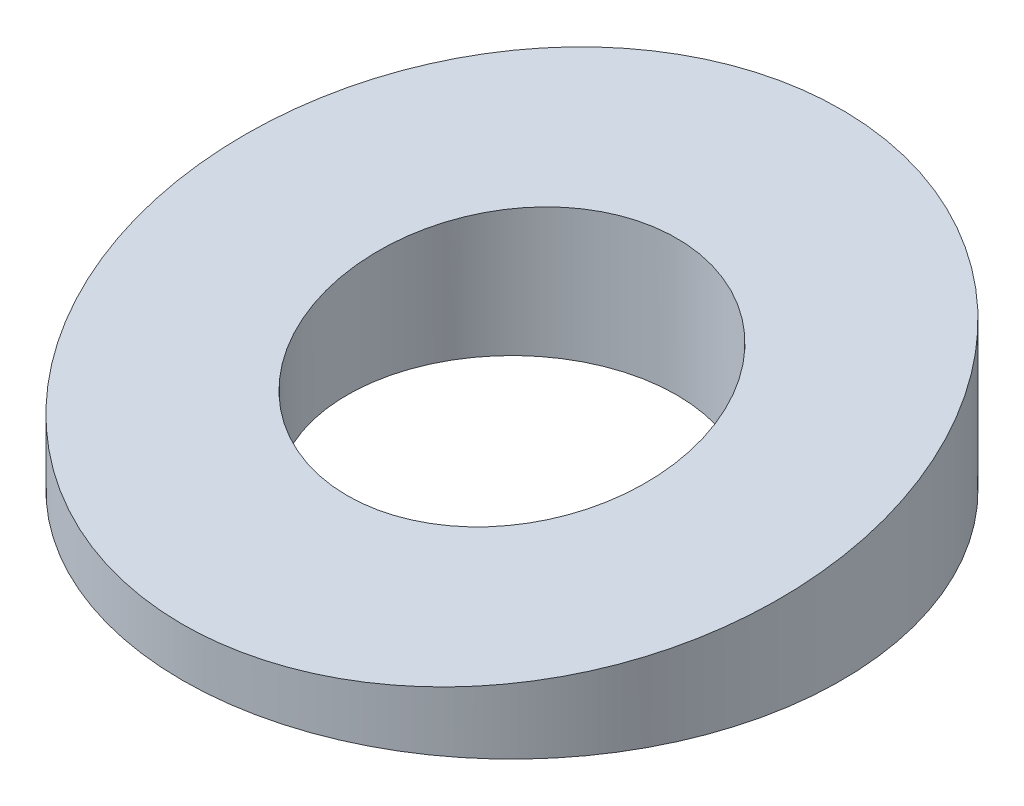
from build123d import *

# Parameters (mm, degrees)
SKETCH1_R               = 4
SKETCH1_R_2             = 2
BOSS_EXTRUDE1_DEPTH     = 2
CUT_EXTRUDE1_DEPTH      = 10
CUT_EXTRUDE1_DEPTH_BACK = 10


with BuildPart() as part:
    # Sketch1 → Boss-Extrude1 (new body)
    with BuildSketch(Plane(origin=(0, 0, 0), x_dir=(1, 0, 0), z_dir=(0, 1, 0))):
        with Locations(Location((0, 0, 0), (0, 0, 270))):
            Circle(SKETCH1_R)
        with Locations(Location((0, 0, 0), (0, 0, 270))):
            Circle(SKETCH1_R_2, mode=Mode.SUBTRACT)
    extrude(amount=BOSS_EXTRUDE1_DEPTH)

    # Sketch2 → Cut-Extrude1 (cut, two sides: drawn at the far end of the back side and taken through both)
    with BuildSketch(Plane(origin=(0, 0, 0), x_dir=(0, 0, -1), z_dir=(1, 0, 0)).offset(-CUT_EXTRUDE1_DEPTH_BACK)):
        Polygon((-4, 2), (4, 2), (-4, 0.589384154), align=None)
    extrude(amount=CUT_EXTRUDE1_DEPTH + CUT_EXTRUDE1_DEPTH_BACK, mode=Mode.SUBTRACT)


solid = part.part
